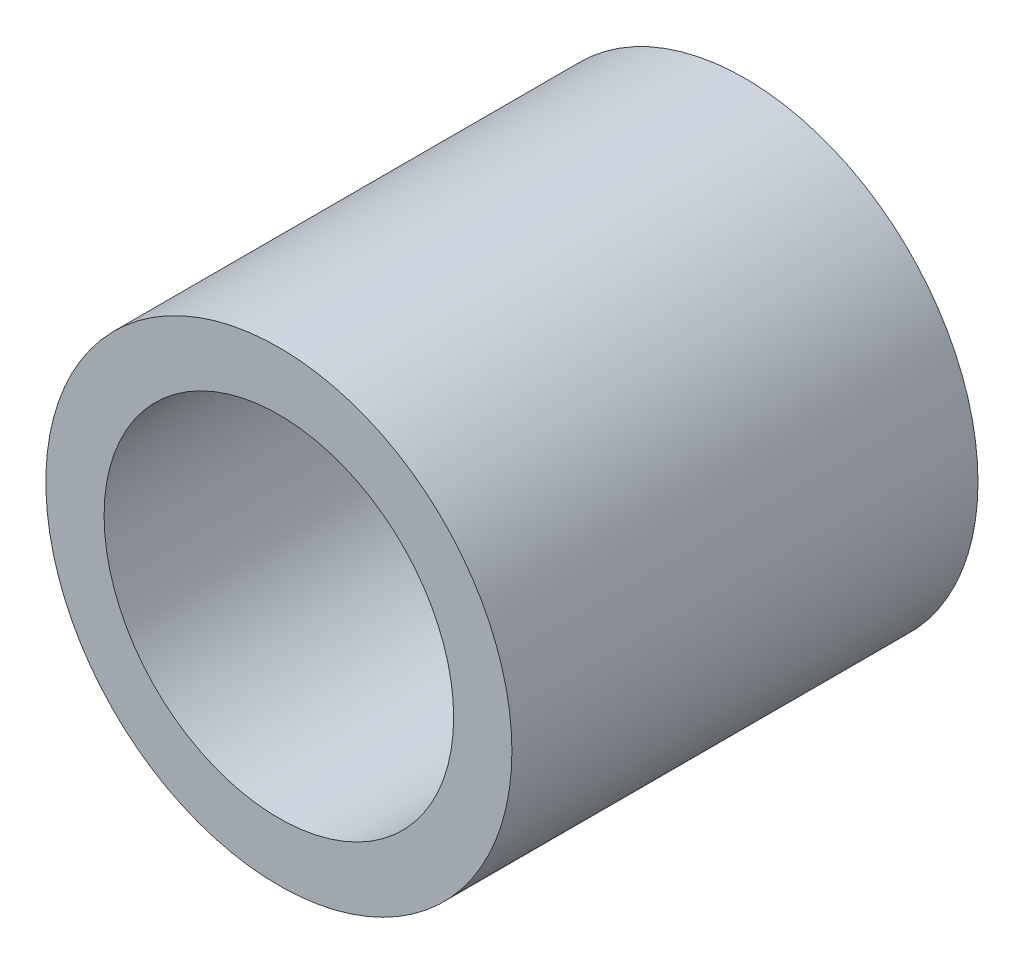
from build123d import *

# Parameters (mm, degrees)
SKETCH_1_R      = 5
SKETCH_1_R_2    = 3.75
EXTRUDE_1_DEPTH = 10


with BuildPart() as part:
    # 草图1 → 凸台-拉伸1 (new body)
    with BuildSketch(Plane.XY):
        Circle(SKETCH_1_R)
        Circle(SKETCH_1_R_2, mode=Mode.SUBTRACT)
    extrude(amount=EXTRUDE_1_DEPTH)


solid = part.part
